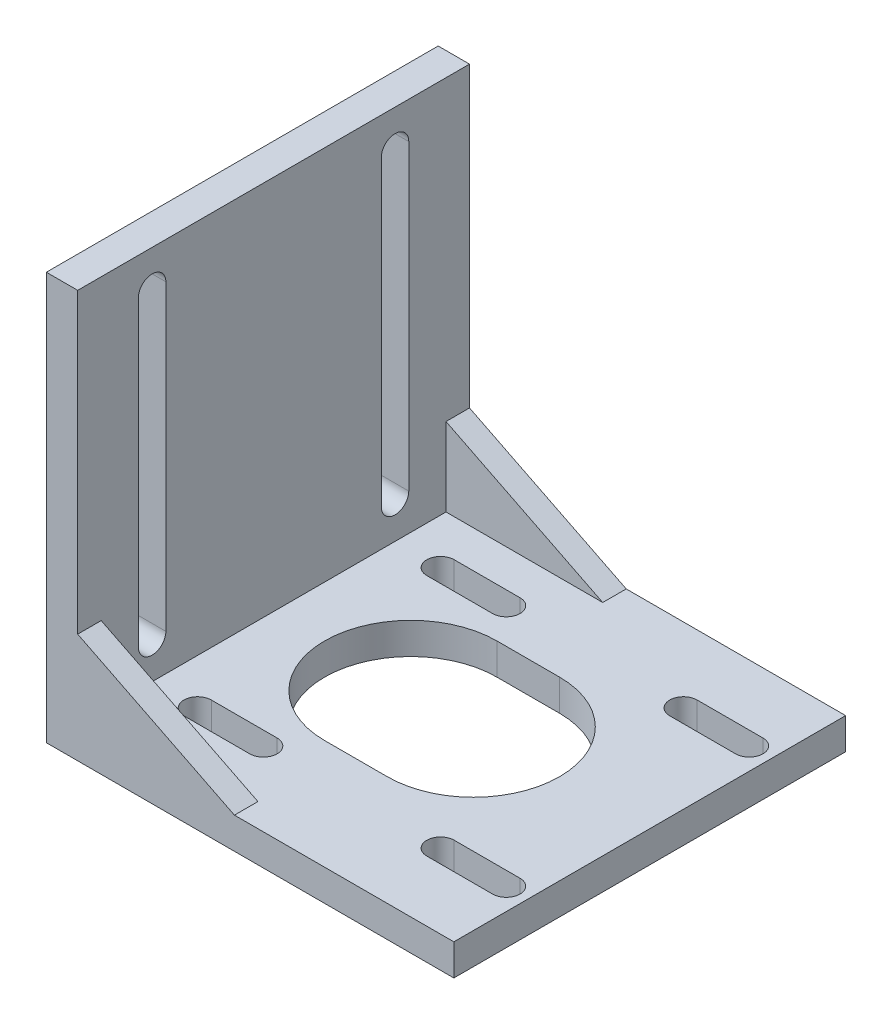
from build123d import *

# Parameters (mm, degrees)
SKETCH1_W           = 52
SKETCH1_H           = 50
BOSS_EXTRUDE1_DEPTH = 4
SKETCH2_R           = 1.75
SKETCH2_R_2         = 11
CUT_EXTRUDE1_DEPTH  = 37.290494623
SKETCH3_W           = 4
SKETCH3_H           = 50
BOSS_EXTRUDE3_DEPTH = 48
BOSS_EXTRUDE4_START = -50
SKETCH5_W           = 20
SKETCH5_H           = 10
BOSS_EXTRUDE4_DEPTH = 50
SKETCH7_W           = 20
SKETCH7_H           = 44
CUT_EXTRUDE2_DEPTH  = 10
CUT_EXTRUDE3_DEPTH  = 77.681158051
CUT_EXTRUDE5_DEPTH  = 78.672388917
CUT_EXTRUDE6_DEPTH  = 61.041652209
CUT_EXTRUDE7_DEPTH  = 64.285069329


with BuildPart() as part:
    # Sketch1 → Boss-Extrude1 (new body)
    with BuildSketch(Plane(origin=(0, 0, 0), x_dir=(1, 0, 0), z_dir=(0, 1, 0))):
        Rectangle(SKETCH1_W, SKETCH1_H)
    extrude(amount=BOSS_EXTRUDE1_DEPTH)

    # Sketch2 → Cut-Extrude1 (cut, through all)
    with BuildSketch(Plane(origin=(0, 4, 0), x_dir=(1, 0, 0), z_dir=(0, 1, 0))):
        with Locations(Location((19, 15.5, 0), (0, 0, 270))):
            Circle(SKETCH2_R)
        with Locations(Location((-12, -15.5, 0), (0, 0, 90))):
            Circle(SKETCH2_R)
        with Locations(Location((19, -15.5, 0), (0, 0, 270))):
            Circle(SKETCH2_R)
        with Locations(Location((-12, 15.5, 0), (0, 0, 90))):
            Circle(SKETCH2_R)
        with Locations(Location((3.5, 0, 0), (0, 0, 270))):
            Circle(SKETCH2_R_2)
    extrude(amount=-CUT_EXTRUDE1_DEPTH, mode=Mode.SUBTRACT)

    # Sketch3 → Boss-Extrude3 (add)
    with BuildSketch(Plane(origin=(0, 4, 0), x_dir=(1, 0, 0), z_dir=(0, 1, 0))):
        with Locations((-24, 0)):
            Rectangle(SKETCH3_W, SKETCH3_H)
    extrude(amount=BOSS_EXTRUDE3_DEPTH)

    # Sketch5 → Boss-Extrude4 (add)
    with BuildSketch(Plane.XY.offset(25).offset(BOSS_EXTRUDE4_START)):
        with Locations((-12, 9)):
            Rectangle(SKETCH5_W, SKETCH5_H)
    extrude(amount=BOSS_EXTRUDE4_DEPTH)

    # Sketch7 → Cut-Extrude2 (cut)
    with BuildSketch(Plane(origin=(0, 14, 0), x_dir=(1, 0, 0), z_dir=(0, 1, 0))):
        with Locations((-12, 0)):
            Rectangle(SKETCH7_W, SKETCH7_H)
    extrude(amount=-CUT_EXTRUDE2_DEPTH, mode=Mode.SUBTRACT)

    # Sketch8 → Cut-Extrude3 (cut, through all)
    with BuildSketch(Plane.XY.offset(25)):
        Polygon((-22, 14), (-2, 4), (-2, 14), align=None)
    extrude(amount=-CUT_EXTRUDE3_DEPTH, mode=Mode.SUBTRACT)

    # Sketch9 → Cut-Extrude5 (cut, through all)
    with BuildSketch(Plane.ZY.offset(26)):
        with BuildLine():
            Line((-13.75, 47.315114044), (-13.75, 8.684885956))
            ThreePointArc((-13.75, 8.684885956), (-15.5, 6.934885956), (-17.25, 8.684885956))
            Line((-17.25, 8.684885956), (-17.25, 47.315114044))
            ThreePointArc((-17.25, 47.315114044), (-15.5, 49.065114044), (-13.75, 47.315114044))
        make_face()
        with BuildLine():
            Line((17.25, 47.315114044), (17.25, 8.684885956))
            ThreePointArc((17.25, 8.684885956), (15.5, 6.934885956), (13.75, 8.684885956))
            Line((13.75, 8.684885956), (13.75, 47.315114044))
            ThreePointArc((13.75, 47.315114044), (15.5, 49.065114044), (17.25, 47.315114044))
        make_face()
    extrude(amount=-CUT_EXTRUDE5_DEPTH, mode=Mode.SUBTRACT)

    # Sketch11 → Cut-Extrude6 (cut, through all)
    with BuildSketch(Plane(origin=(0, 4, 0), x_dir=(1, 0, 0), z_dir=(0, 1, 0))):
        with BuildLine():
            Line((-16.2, 17.25), (-7.8, 17.25))
            ThreePointArc((-7.8, 17.25), (-6.05, 15.5), (-7.8, 13.75))
            Line((-7.8, 13.75), (-16.2, 13.75))
            ThreePointArc((-16.2, 13.75), (-17.95, 15.5), (-16.2, 17.25))
        make_face()
        with BuildLine():
            Line((-16.2, -17.25), (-7.8, -17.25))
            ThreePointArc((-7.8, -17.25), (-6.05, -15.5), (-7.8, -13.75))
            Line((-7.8, -13.75), (-16.2, -13.75))
            ThreePointArc((-16.2, -13.75), (-17.95, -15.5), (-16.2, -17.25))
        make_face()
        with BuildLine():
            Line((23.2, 13.75), (14.8, 13.75))
            ThreePointArc((14.8, 13.75), (13.05, 15.5), (14.8, 17.25))
            Line((14.8, 17.25), (23.2, 17.25))
            ThreePointArc((23.2, 17.25), (24.95, 15.5), (23.2, 13.75))
        make_face()
        with BuildLine():
            Line((23.2, -13.75), (14.8, -13.75))
            ThreePointArc((14.8, -13.75), (13.05, -15.5), (14.8, -17.25))
            Line((14.8, -17.25), (23.2, -17.25))
            ThreePointArc((23.2, -17.25), (24.95, -15.5), (23.2, -13.75))
        make_face()
    extrude(amount=-CUT_EXTRUDE6_DEPTH, mode=Mode.SUBTRACT)

    # Sketch12 → Cut-Extrude7 (cut, through all)
    with BuildSketch(Plane.XZ):
        with BuildLine():
            Line((3.5, -11), (-4.5, -11))
            ThreePointArc((-4.5, -11), (-15.5, 0), (-4.5, 11))
            Line((-4.5, 11), (3.5, 11))
            ThreePointArc((3.5, 11), (14.5, 0), (3.5, -11))
        make_face()
    extrude(amount=-CUT_EXTRUDE7_DEPTH, mode=Mode.SUBTRACT)


solid = part.part
